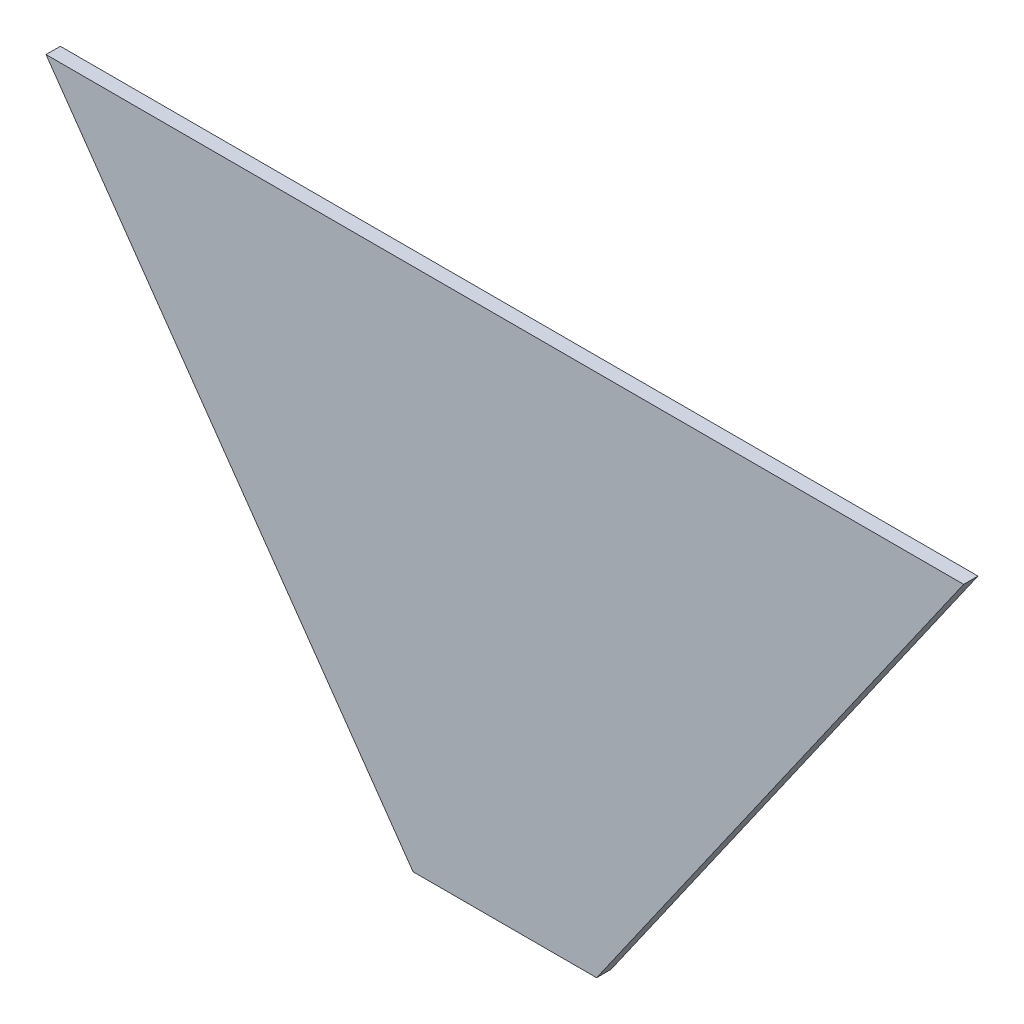
from build123d import *

# Parameters (mm, degrees)
BOSS_EXTRUDE1_DEPTH = 1.5875


with BuildPart() as part:
    # Sketch1 → Boss-Extrude1 (new body)
    with BuildSketch(Plane.XY):
        Polygon((-10.16, 0), (10.16, 0), (50.8, 58.039934994), (-50.8, 58.039934994), align=None)
    extrude(amount=BOSS_EXTRUDE1_DEPTH)


solid = part.part
